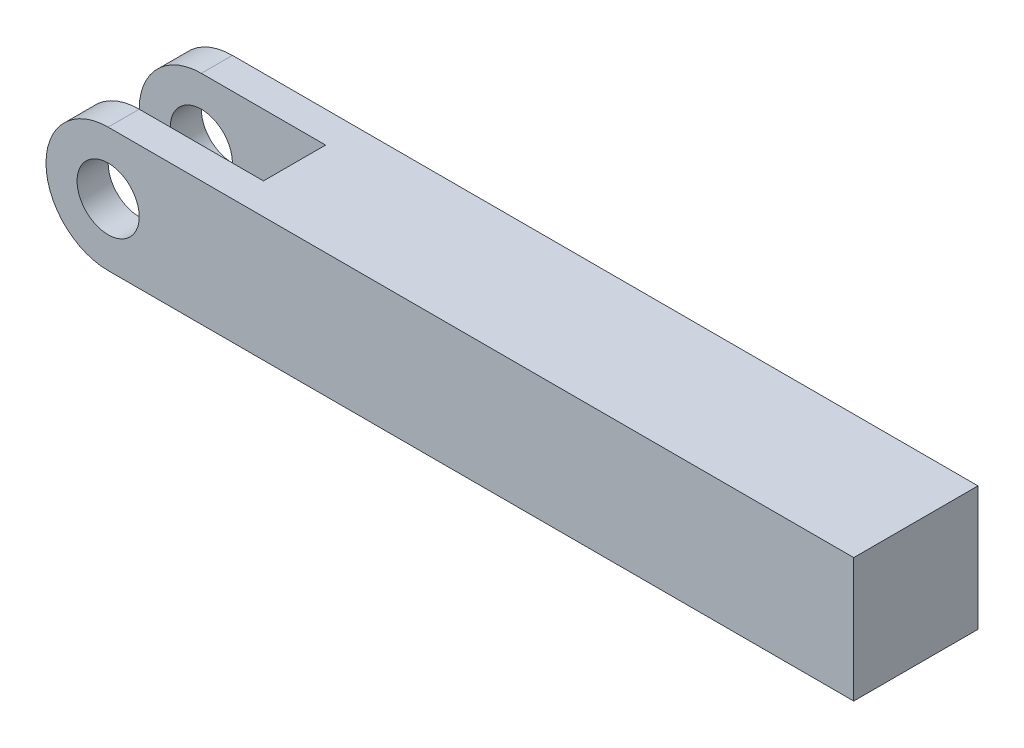
from build123d import *

# Parameters (mm, degrees)
SKETCH_1_W      = 50
SKETCH_1_H      = 10
EXTRUDE_1_DEPTH = 5
SKETCH_2_R      = 2.5
EXTRUDE_2_DEPTH = 2.5


with BuildPart() as part:
    # 草图1 → 凸台-拉伸1 (new, symmetric)
    with BuildSketch(Plane.XY):
        Rectangle(SKETCH_1_W, SKETCH_1_H)
    extrude(amount=EXTRUDE_1_DEPTH, both=True)

    # 草图2 → 凸台-拉伸2 (add)
    with BuildSketch(Plane(origin=(0, 0, -5), x_dir=(-1, 0, 0), z_dir=(0, 0, -1))):
        with BuildLine():
            Line((25, 5), (35, 5))
            ThreePointArc((35, 5), (40, 0), (35, -5))
            Line((35, -5), (25, -5))
            Line((25, -5), (25, 5))
        make_face()
        with Locations((35, 0)):
            Circle(SKETCH_2_R, mode=Mode.SUBTRACT)
    extrude_2 = extrude(amount=-EXTRUDE_2_DEPTH)

    # 镜向1: 凸台-拉伸2 across plane
    add(extrude_2.mirror(Plane.XY))


solid = part.part
